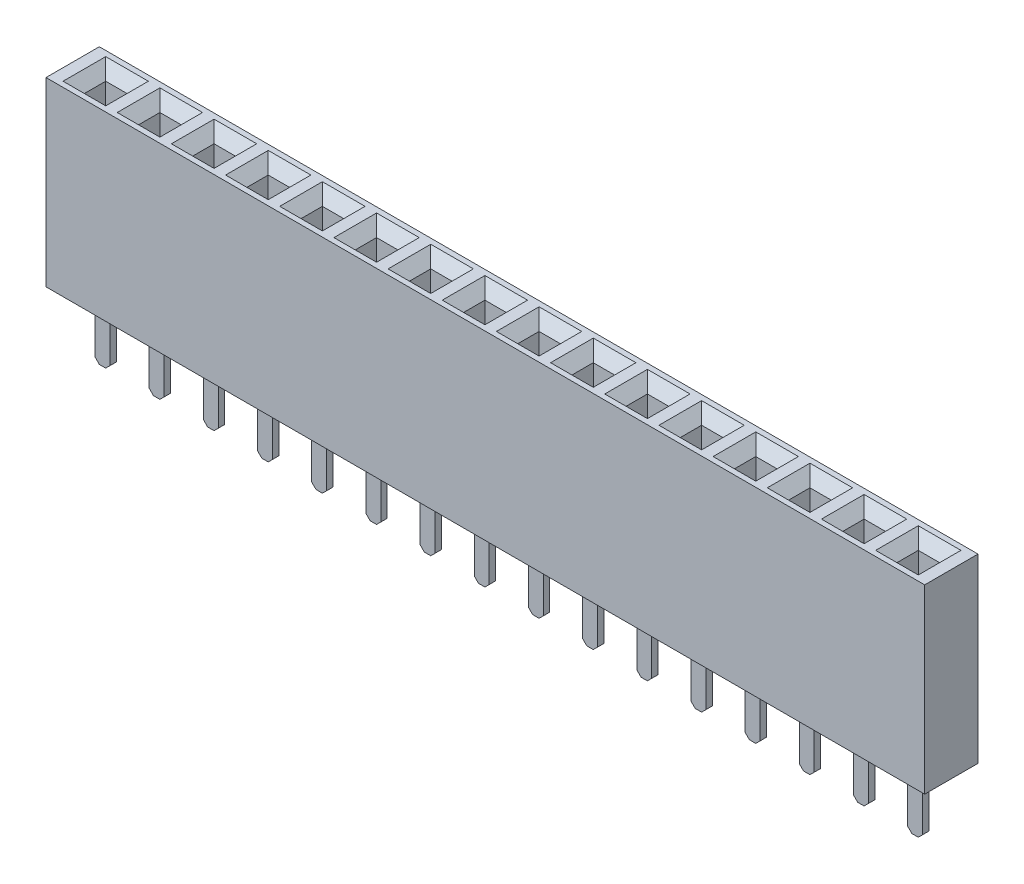
from build123d import *

# Parameters (mm, degrees)
SKETCH_1_W          = 41.2
SKETCH_1_H          = 2.5
EXTRUDE_1_DEPTH     = 8.5
SKETCH_2_W          = 1
SKETCH_2_H          = 1
CUT_EXTRUDE_1_DEPTH = 7
CHAMFER_2_SIZE      = 0.5
SKETCH_3_W          = 0.7
SKETCH_3_H          = 0.3
EXTRUDE_2_DEPTH     = 3
CHAMFER_3_SIZE      = 0.2


with BuildPart() as part:
    # Эскиз1 → Бобышка-Вытянуть1 (new body)
    with BuildSketch(Plane(origin=(0, 0, 0), x_dir=(1, 0, 0), z_dir=(0, 1, 0))):
        Rectangle(SKETCH_1_W, SKETCH_1_H)
    extrude(amount=EXTRUDE_1_DEPTH)

    # Эскиз2 → Вырез-Вытянуть1 (cut)
    with BuildSketch(Plane(origin=(0, 8.5, 0), x_dir=(1, 0, 0), z_dir=(0, 1, 0))):
        with Locations((-16.51, 0)):
            Rectangle(SKETCH_2_W, SKETCH_2_H)
        with Locations((-19.05, 0)):
            Rectangle(SKETCH_2_W, SKETCH_2_H)
        with Locations((-13.97, 0)):
            Rectangle(SKETCH_2_W, SKETCH_2_H)
        with Locations((-11.43, 0)):
            Rectangle(SKETCH_2_W, SKETCH_2_H)
        with Locations((-8.89, 0)):
            Rectangle(SKETCH_2_W, SKETCH_2_H)
        with Locations((-6.35, 0)):
            Rectangle(SKETCH_2_W, SKETCH_2_H)
        with Locations((-3.81, 0)):
            Rectangle(SKETCH_2_W, SKETCH_2_H)
        with Locations((-1.27, 0)):
            Rectangle(SKETCH_2_W, SKETCH_2_H)
        with Locations((1.27, 0)):
            Rectangle(SKETCH_2_W, SKETCH_2_H)
        with Locations((3.81, 0)):
            Rectangle(SKETCH_2_W, SKETCH_2_H)
        with Locations((6.35, 0)):
            Rectangle(SKETCH_2_W, SKETCH_2_H)
        with Locations((8.89, 0)):
            Rectangle(SKETCH_2_W, SKETCH_2_H)
        with Locations((11.43, 0)):
            Rectangle(SKETCH_2_W, SKETCH_2_H)
        with Locations((13.97, 0)):
            Rectangle(SKETCH_2_W, SKETCH_2_H)
        with Locations((16.51, 0)):
            Rectangle(SKETCH_2_W, SKETCH_2_H)
        with Locations((19.05, 0)):
            Rectangle(SKETCH_2_W, SKETCH_2_H)
    extrude(amount=-CUT_EXTRUDE_1_DEPTH, mode=Mode.SUBTRACT)

    # Фаска2
    chamfer_2_edges = [part.edges().sort_by_distance(p)[0] for p in [
        (4.31, 8.5, 0),
        (3.81, 8.5, -0.5),
        (3.31, 8.5, 0),
        (3.81, 8.5, 0.5),
        (6.85, 8.5, 0),
        (6.35, 8.5, -0.5),
        (5.85, 8.5, 0),
        (6.35, 8.5, 0.5),
        (9.39, 8.5, 0),
        (8.89, 8.5, -0.5),
        (8.39, 8.5, 0),
        (8.89, 8.5, 0.5),
        (11.93, 8.5, 0),
        (11.43, 8.5, -0.5),
        (10.93, 8.5, 0),
        (11.43, 8.5, 0.5),
        (14.47, 8.5, 0),
        (13.97, 8.5, -0.5),
        (13.47, 8.5, 0),
        (13.97, 8.5, 0.5),
        (17.01, 8.5, 0),
        (16.51, 8.5, -0.5),
        (16.01, 8.5, 0),
        (16.51, 8.5, 0.5),
        (19.55, 8.5, 0),
        (19.05, 8.5, -0.5),
        (18.55, 8.5, 0),
        (19.05, 8.5, 0.5),
        (-18.55, 8.5, 0),
        (-19.05, 8.5, -0.5),
        (-19.55, 8.5, 0),
        (-19.05, 8.5, 0.5),
        (-16.01, 8.5, 0),
        (-16.51, 8.5, -0.5),
        (-17.01, 8.5, 0),
        (-16.51, 8.5, 0.5),
        (-13.47, 8.5, 0),
        (-13.97, 8.5, -0.5),
        (-14.47, 8.5, 0),
        (-13.97, 8.5, 0.5),
        (-10.93, 8.5, 0),
        (-11.43, 8.5, -0.5),
        (-11.93, 8.5, 0),
        (-11.43, 8.5, 0.5),
        (-8.39, 8.5, 0),
        (-8.89, 8.5, -0.5),
        (-9.39, 8.5, 0),
        (-8.89, 8.5, 0.5),
        (-5.85, 8.5, 0),
        (-6.35, 8.5, -0.5),
        (-6.85, 8.5, 0),
        (-6.35, 8.5, 0.5),
        (-3.31, 8.5, 0),
        (-3.81, 8.5, -0.5),
        (-4.31, 8.5, 0),
        (-3.81, 8.5, 0.5),
        (-0.77, 8.5, 0),
        (-1.27, 8.5, -0.5),
        (-1.77, 8.5, 0),
        (-1.27, 8.5, 0.5),
        (1.77, 8.5, 0),
        (1.27, 8.5, -0.5),
        (0.77, 8.5, 0),
        (1.27, 8.5, 0.5),
    ]]
    chamfer(chamfer_2_edges, length=CHAMFER_2_SIZE)

    # Эскиз3 → Бобышка-Вытянуть2 (add)
    with BuildSketch(Plane.XZ):
        with Locations((16.51, 0)):
            Rectangle(SKETCH_3_W, SKETCH_3_H)
        with Locations((19.05, 0)):
            Rectangle(SKETCH_3_W, SKETCH_3_H)
        with Locations((13.97, 0)):
            Rectangle(SKETCH_3_W, SKETCH_3_H)
        with Locations((11.43, 0)):
            Rectangle(SKETCH_3_W, SKETCH_3_H)
        with Locations((8.89, 0)):
            Rectangle(SKETCH_3_W, SKETCH_3_H)
        with Locations((6.35, 0)):
            Rectangle(SKETCH_3_W, SKETCH_3_H)
        with Locations((3.81, 0)):
            Rectangle(SKETCH_3_W, SKETCH_3_H)
        with Locations((1.27, 0)):
            Rectangle(SKETCH_3_W, SKETCH_3_H)
        with Locations((-1.27, 0)):
            Rectangle(SKETCH_3_W, SKETCH_3_H)
        with Locations((-3.81, 0)):
            Rectangle(SKETCH_3_W, SKETCH_3_H)
        with Locations((-6.35, 0)):
            Rectangle(SKETCH_3_W, SKETCH_3_H)
        with Locations((-8.89, 0)):
            Rectangle(SKETCH_3_W, SKETCH_3_H)
        with Locations((-11.43, 0)):
            Rectangle(SKETCH_3_W, SKETCH_3_H)
        with Locations((-13.97, 0)):
            Rectangle(SKETCH_3_W, SKETCH_3_H)
        with Locations((-16.51, 0)):
            Rectangle(SKETCH_3_W, SKETCH_3_H)
        with Locations((-19.05, 0)):
            Rectangle(SKETCH_3_W, SKETCH_3_H)
    extrude(amount=EXTRUDE_2_DEPTH)

    # Фаска3
    chamfer_3_edges = [part.edges().sort_by_distance(p)[0] for p in [
        (18.7, -3, 0),
        (19.4, -3, 0),
        (16.16, -3, 0),
        (16.86, -3, 0),
        (13.62, -3, 0),
        (14.32, -3, 0),
        (11.08, -3, 0),
        (11.78, -3, 0),
        (8.54, -3, 0),
        (9.24, -3, 0),
        (6, -3, 0),
        (6.7, -3, 0),
        (3.46, -3, 0),
        (4.16, -3, 0),
        (0.92, -3, 0),
        (1.62, -3, 0),
        (-1.62, -3, 0),
        (-0.92, -3, 0),
        (-4.16, -3, 0),
        (-3.46, -3, 0),
        (-6.7, -3, 0),
        (-6, -3, 0),
        (-9.24, -3, 0),
        (-8.54, -3, 0),
        (-11.78, -3, 0),
        (-11.08, -3, 0),
        (-14.32, -3, 0),
        (-13.62, -3, 0),
        (-16.86, -3, 0),
        (-16.16, -3, 0),
        (-19.4, -3, 0),
        (-18.7, -3, 0),
    ]]
    chamfer(chamfer_3_edges, length=CHAMFER_3_SIZE)


solid = part.part
